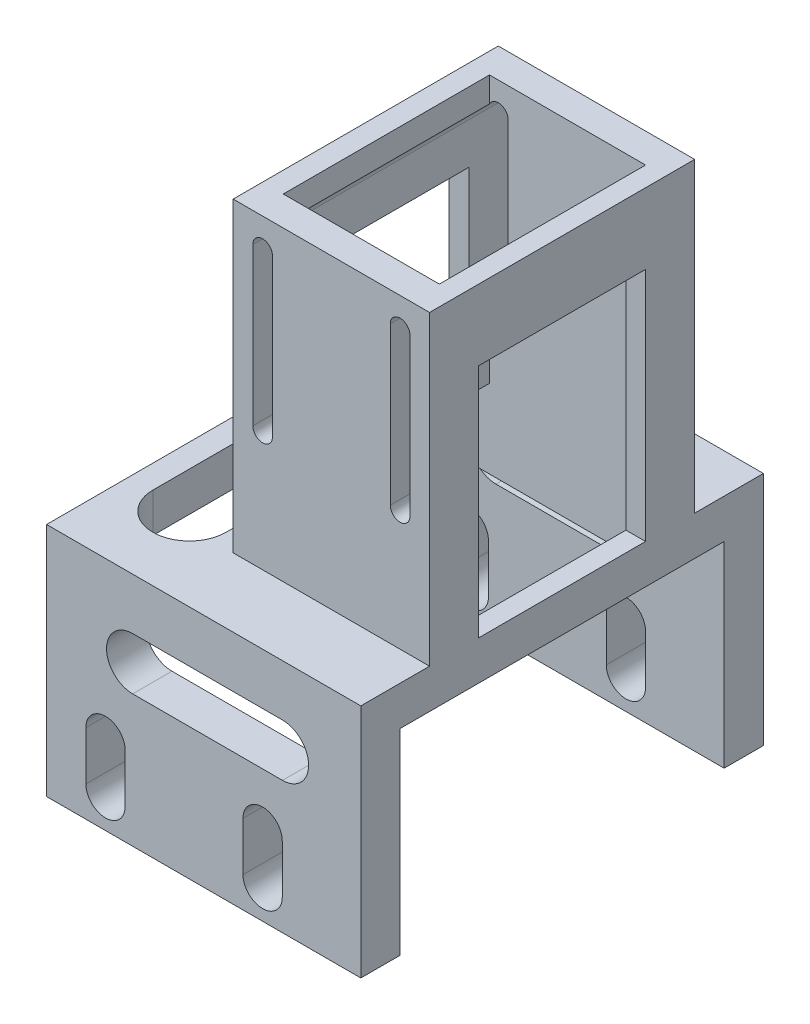
from build123d import *

# Parameters (mm, degrees)
SKETCH1_W           = 50.8
SKETCH1_H           = 65.0875
BOSS_EXTRUDE1_DEPTH = 6.35
SKETCH2_W           = 50.8
SKETCH2_H           = 6.35
BOSS_EXTRUDE2_DEPTH = 31.75
SKETCH4_W           = 25.233918668
SKETCH4_H           = 33.3375
CUT_EXTRUDE1_DEPTH  = 31.75
SKETCH5_W           = 31.75
SKETCH5_H           = 42.8625
BOSS_EXTRUDE3_DEPTH = 49.53
SKETCH4_2_W         = 25.233918668
SKETCH4_2_H         = 33.3375
CUT_EXTRUDE2_DEPTH  = 58.7375
CUT_EXTRUDE4_DEPTH  = 58.7375
SKETCH8_W           = 26.9875
SKETCH8_H           = 38.1
CUT_EXTRUDE7_DEPTH  = 58.7375
SKETCH12_W          = 3.208041114
SKETCH12_H          = 30.1625
CUT_EXTRUDE13_DEPTH = 12.7
CUT_EXTRUDE14_DEPTH = 76.2
CUT_EXTRUDE15_DEPTH = 76.2
CUT_EXTRUDE16_DEPTH = 76.2


with BuildPart() as part:
    # Sketch1 → Boss-Extrude1 (new body)
    with BuildSketch(Plane(origin=(0, 0, 0), x_dir=(1, 0, 0), z_dir=(0, 1, 0))):
        Rectangle(SKETCH1_W, SKETCH1_H)
    extrude(amount=BOSS_EXTRUDE1_DEPTH)

    # Sketch2 → Boss-Extrude2 (add)
    with BuildSketch(Plane(origin=(0, 0, 0), x_dir=(-1, 0, 0), z_dir=(0, -1, 0))):
        with Locations((0, -29.36875)):
            Rectangle(SKETCH2_W, SKETCH2_H)
        with Locations((0, 29.36875)):
            Rectangle(SKETCH2_W, SKETCH2_H)
    extrude(amount=BOSS_EXTRUDE2_DEPTH)

    # Sketch4 → Cut-Extrude1 (cut)
    with BuildSketch(Plane(origin=(0, 6.35, 0), x_dir=(1, 0, 0), z_dir=(0, 1, 0))):
        with Locations((9.608040666, 0)):
            Rectangle(SKETCH4_W, SKETCH4_H)
    extrude(amount=-CUT_EXTRUDE1_DEPTH, mode=Mode.SUBTRACT)

    # Sketch5 → Boss-Extrude3 (add)
    with BuildSketch(Plane(origin=(0, 6.35, 0), x_dir=(1, 0, 0), z_dir=(0, 1, 0))):
        with Locations((9.525, 0)):
            Rectangle(SKETCH5_W, SKETCH5_H)
    extrude(amount=BOSS_EXTRUDE3_DEPTH)

    # Sketch4<2> → Cut-Extrude2 (cut)
    with BuildSketch(Plane(origin=(0, 6.35, 0), x_dir=(1, 0, 0), z_dir=(0, 1, 0))):
        with Locations((9.608040666, 0)):
            Rectangle(SKETCH4_2_W, SKETCH4_2_H)
    extrude(amount=CUT_EXTRUDE2_DEPTH, mode=Mode.SUBTRACT)

    # Sketch7 → Cut-Extrude4 (cut)
    with BuildSketch(Plane.XY.offset(21.43125)):
        with BuildLine():
            Line((19.05, 25.7175), (19.05, 51.1175))
            ThreePointArc((19.05, 51.1175), (20.6375, 52.705), (22.225, 51.1175))
            Line((22.225, 51.1175), (22.225, 25.7175))
            ThreePointArc((22.225, 25.7175), (20.6375, 24.13), (19.05, 25.7175))
        make_face()
        with BuildLine():
            Line((0, 51.1175), (0, 25.7175))
            ThreePointArc((0, 25.7175), (-1.5875, 24.13), (-3.175, 25.7175))
            Line((-3.175, 25.7175), (-3.175, 51.1175))
            ThreePointArc((-3.175, 51.1175), (-1.5875, 52.705), (0, 51.1175))
        make_face()
    extrude(amount=-CUT_EXTRUDE4_DEPTH, mode=Mode.SUBTRACT)

    # Sketch8 → Cut-Extrude7 (cut)
    with BuildSketch(Plane(origin=(25.4, 0, 0), x_dir=(0, 0, -1), z_dir=(1, 0, 0))):
        with Locations((0, 25.4)):
            Rectangle(SKETCH8_W, SKETCH8_H)
    extrude(amount=-CUT_EXTRUDE7_DEPTH, mode=Mode.SUBTRACT)

    # Sketch12 → Cut-Extrude13 (cut)
    with BuildSketch(Plane(origin=(0, 0, 0), x_dir=(-1, 0, 0), z_dir=(0, -1, 0))):
        with Locations((4.612939225, 1.5875)):
            Rectangle(SKETCH12_W, SKETCH12_H)
    extrude(amount=-CUT_EXTRUDE13_DEPTH, mode=Mode.SUBTRACT)

    # Sketch14 → Cut-Extrude14 (cut)
    with BuildSketch(Plane.XY.offset(32.54375)):
        with BuildLine():
            Line((12.7, -18.919342158), (12.7, -26.800657842))
            ThreePointArc((12.7, -26.800657842), (9.525, -29.975657842), (6.35, -26.800657842))
            Line((6.35, -26.800657842), (6.35, -18.919342158))
            ThreePointArc((6.35, -18.919342158), (9.525, -15.744342158), (12.7, -18.919342158))
        make_face()
        with BuildLine():
            Line((-12.7, -18.919342158), (-12.7, -26.800657842))
            ThreePointArc((-12.7, -26.800657842), (-15.875, -29.975657842), (-19.05, -26.800657842))
            Line((-19.05, -26.800657842), (-19.05, -18.919342158))
            ThreePointArc((-19.05, -18.919342158), (-15.875, -15.744342158), (-12.7, -18.919342158))
        make_face()
    extrude(amount=-CUT_EXTRUDE14_DEPTH, mode=Mode.SUBTRACT)

    # Sketch15 → Cut-Extrude15 (cut)
    with BuildSketch(Plane.XY.offset(32.54375)):
        with BuildLine():
            Line((-11.481562965, -1.962227272), (12.734603348, -1.962227272))
            ThreePointArc((12.734603348, -1.962227272), (16.958353287, -6.18597721), (12.734603348, -10.409727149))
            Line((12.734603348, -10.409727149), (-11.481562965, -10.409727149))
            ThreePointArc((-11.481562965, -10.409727149), (-15.705312903, -6.18597721), (-11.481562965, -1.962227272))
        make_face()
    extrude(amount=-CUT_EXTRUDE15_DEPTH, mode=Mode.SUBTRACT)

    # Sketch16 → Cut-Extrude16 (cut)
    with BuildSketch(Plane(origin=(0, 6.35, 0), x_dir=(1, 0, 0), z_dir=(0, 1, 0))):
        with BuildLine():
            Line((-9.797813027, 19.133291295), (-9.797813027, -19.133291295))
            ThreePointArc((-9.797813027, -19.133291295), (-15.71106294, -25.046541209), (-21.624312854, -19.133291295))
            Line((-21.624312854, -19.133291295), (-21.624312854, 19.133291295))
            ThreePointArc((-21.624312854, 19.133291295), (-15.71106294, 25.046541209), (-9.797813027, 19.133291295))
        make_face()
    extrude(amount=-CUT_EXTRUDE16_DEPTH, mode=Mode.SUBTRACT)


solid = part.part
